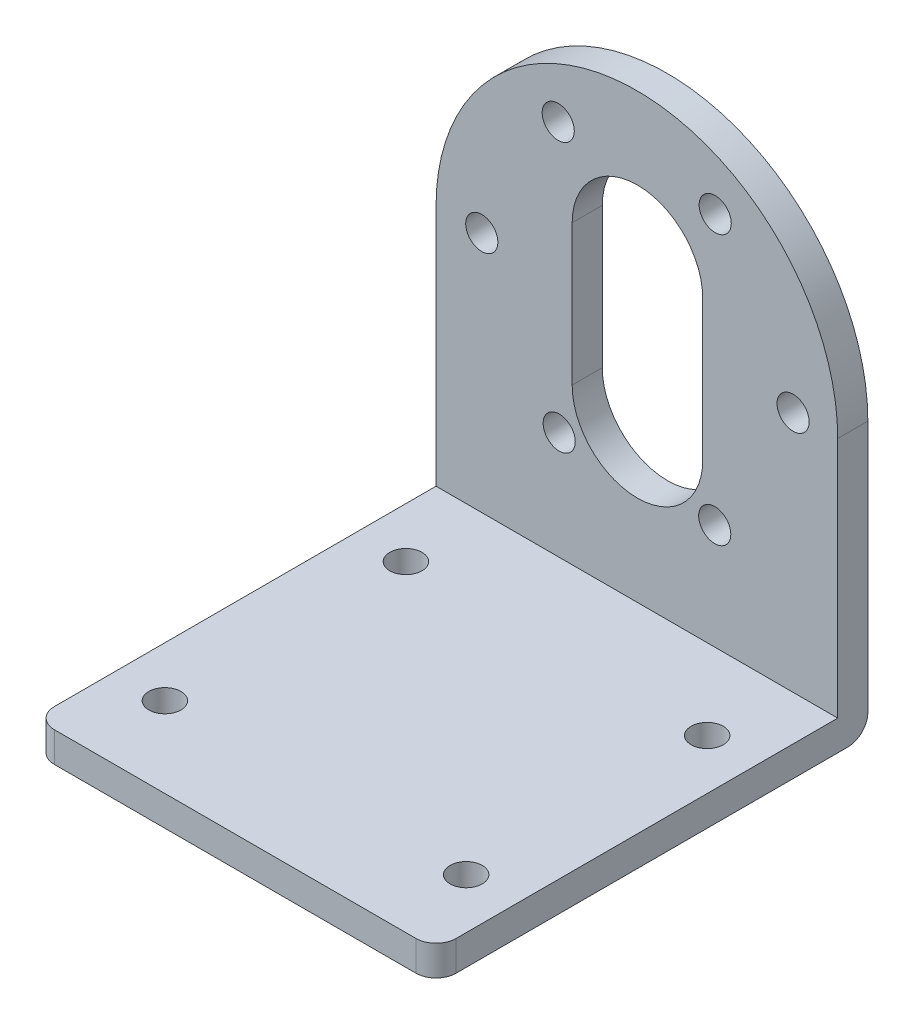
from build123d import *

# Parameters (mm, degrees)
SKETCH_1_R          = 1.6
EXTRUDE_4_DEPTH     = 3
SKETCH_2_W          = 40
SKETCH_2_H          = 3
EXTRUDE_5_DEPTH     = 43
SKETCH_3_R          = 1.6
CUT_EXTRUDE_1_DEPTH = 63.306805946
FILLET_5_R          = 2
FILLET_6_R          = 2
FILLET_7_R          = 2


with BuildPart() as part:
    # 草图1 → 凸台-拉伸4 (new body)
    with BuildSketch(Plane.XY):
        with BuildLine():
            Line((-17.213055582, 18.908780902), (-17.213055582, -5.203950579))
            Line((-17.213055582, -5.203950579), (22.786944418, -5.203950579))
            Line((22.786944418, -5.203950579), (22.786944418, 18.908780902))
            ThreePointArc((22.786944418, 18.908780902), (2.786944418, 38.908780902), (-17.213055582, 18.908780902))
        make_face()
        with Locations((-4.94763916, 5.557362749)):
            Circle(SKETCH_1_R, mode=Mode.SUBTRACT)
        with Locations((10.539247833, 5.319833808)):
            Circle(SKETCH_1_R, mode=Mode.SUBTRACT)
        with Locations((-12.656689842, 18.908780902)):
            Circle(SKETCH_1_R, mode=Mode.SUBTRACT)
        with Locations((-5.045757748, 32.297473855)):
            Circle(SKETCH_1_R, mode=Mode.SUBTRACT)
        with BuildLine():
            ThreePointArc((9.343310158, 10.296049421), (2.843310158, 3.796049421), (-3.656689842, 10.296049421))
            Line((-3.656689842, 10.296049421), (-3.656689842, 24.296049421))
            ThreePointArc((-3.656689842, 24.296049421), (2.843310158, 30.796049421), (9.343310158, 24.296049421))
            Line((9.343310158, 24.296049421), (9.343310158, 10.296049421))
        make_face(mode=Mode.SUBTRACT)
        with Locations((18.343310158, 18.908780902)):
            Circle(SKETCH_1_R, mode=Mode.SUBTRACT)
        with Locations((10.586753622, 32.160604209)):
            Circle(SKETCH_1_R, mode=Mode.SUBTRACT)
    extrude(amount=EXTRUDE_4_DEPTH)

    # 草图2 → 凸台-拉伸5 (add)
    with BuildSketch(Plane.XY):
        with Locations((2.786944418, -6.703950579)):
            Rectangle(SKETCH_2_W, SKETCH_2_H)
    extrude(amount=EXTRUDE_5_DEPTH)

    # 草图3 → 切除-拉伸1 (cut, through all)
    with BuildSketch(Plane(origin=(0, 0, 0), x_dir=(1, 0, 0), z_dir=(0, 1, 0))):
        with Locations(Location((-12.213055582, -35, 0), (0, 0, 270))):
            Circle(SKETCH_3_R)
        with Locations(Location((17.786944418, -35, 0), (0, 0, 270))):
            Circle(SKETCH_3_R)
        with Locations(Location((17.786944418, -11, 0), (0, 0, 270))):
            Circle(SKETCH_3_R)
        with Locations(Location((-12.213055582, -11, 0), (0, 0, 270))):
            Circle(SKETCH_3_R)
    extrude(amount=-CUT_EXTRUDE_1_DEPTH, mode=Mode.SUBTRACT)

    # 圆角5
    fillet_5_edges = [part.edges().sort_by_distance(p)[0] for p in [
        (22.786944418, -6.703950579, 43),
    ]]
    fillet(fillet_5_edges, radius=FILLET_5_R)

    # 圆角6
    fillet_6_edges = [part.edges().sort_by_distance(p)[0] for p in [
        (-17.213055582, -6.703950579, 43),
    ]]
    fillet(fillet_6_edges, radius=FILLET_6_R)

    # 圆角7
    fillet_7_edges = [part.edges().sort_by_distance(p)[0] for p in [
        (2.786944418, -8.203950579, 0),
    ]]
    fillet(fillet_7_edges, radius=FILLET_7_R)


solid = part.part
